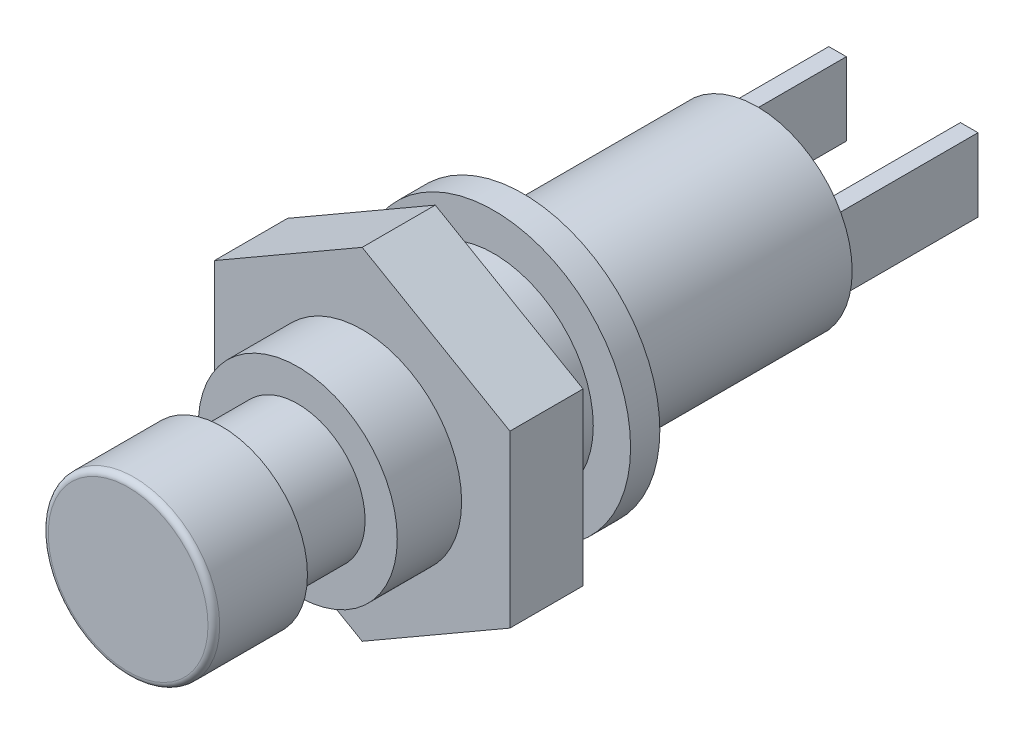
from build123d import *

# Parameters (mm, degrees)
SKETCH1_R        = 4.675
COLLAR_DEPTH     = 1
SKETCH2_R        = 3.4
FRONT_BODY_DEPTH = 6.7
SKETCH4_R        = 2.3
SHAFT_DEPTH      = 2.6
SKETCH5_R        = 2.93
KNOB_DEPTH       = 3.2
KNOB_FILLET_R    = 0.2
SKETCH3_R        = 3.25
REAR_BODY_DEPTH  = 9
SKETCH6_W        = 0.6
SKETCH6_H        = 2.5
PINS_DEPTH       = 5
NUT_DEPTH        = 2.5


with BuildPart() as part:
    # Sketch1 → Collar (new body)
    with BuildSketch(Plane.XY):
        Circle(SKETCH1_R)
    extrude(amount=-COLLAR_DEPTH)

    # Sketch2 → Front Body (add)
    with BuildSketch(Plane.XY):
        Circle(SKETCH2_R)
    extrude(amount=FRONT_BODY_DEPTH)

    # Sketch4 → Shaft (add)
    with BuildSketch(Plane.XY.offset(6.7)):
        Circle(SKETCH4_R)
    extrude(amount=SHAFT_DEPTH)

    # Sketch5 → Knob (add)
    with BuildSketch(Plane.XY.offset(9.3)):
        Circle(SKETCH5_R)
    extrude(amount=KNOB_DEPTH)

    # Knob Fillet
    knob_fillet_edges = [part.edges().sort_by_distance(p)[0] for p in [
        (-2.93, 0, 12.5),
    ]]
    fillet(knob_fillet_edges, radius=KNOB_FILLET_R)

    # Sketch3 → Rear Body (add)
    with BuildSketch(Plane.XY):
        Circle(SKETCH3_R)
    extrude(amount=-REAR_BODY_DEPTH)

    # Sketch6 → Pins (add)
    with BuildSketch(Plane(origin=(0, 0, -9), x_dir=(-1, 0, 0), z_dir=(0, 0, -1))):
        with Locations((-2.25, 0)):
            Rectangle(SKETCH6_W, SKETCH6_H)
        with Locations((2.25, 0)):
            Rectangle(SKETCH6_W, SKETCH6_H)
    extrude(amount=PINS_DEPTH)

    # Sketch7 → Nut (add)
    with BuildSketch(Plane.XY.offset(2)):
        Polygon((0, 5.831237719), (-5.05, 2.915618859), (-5.05, -2.915618859), (0, -5.831237719), (5.05, -2.915618859), (5.05, 2.915618859), align=None)
    extrude(amount=NUT_DEPTH)


solid = part.part
